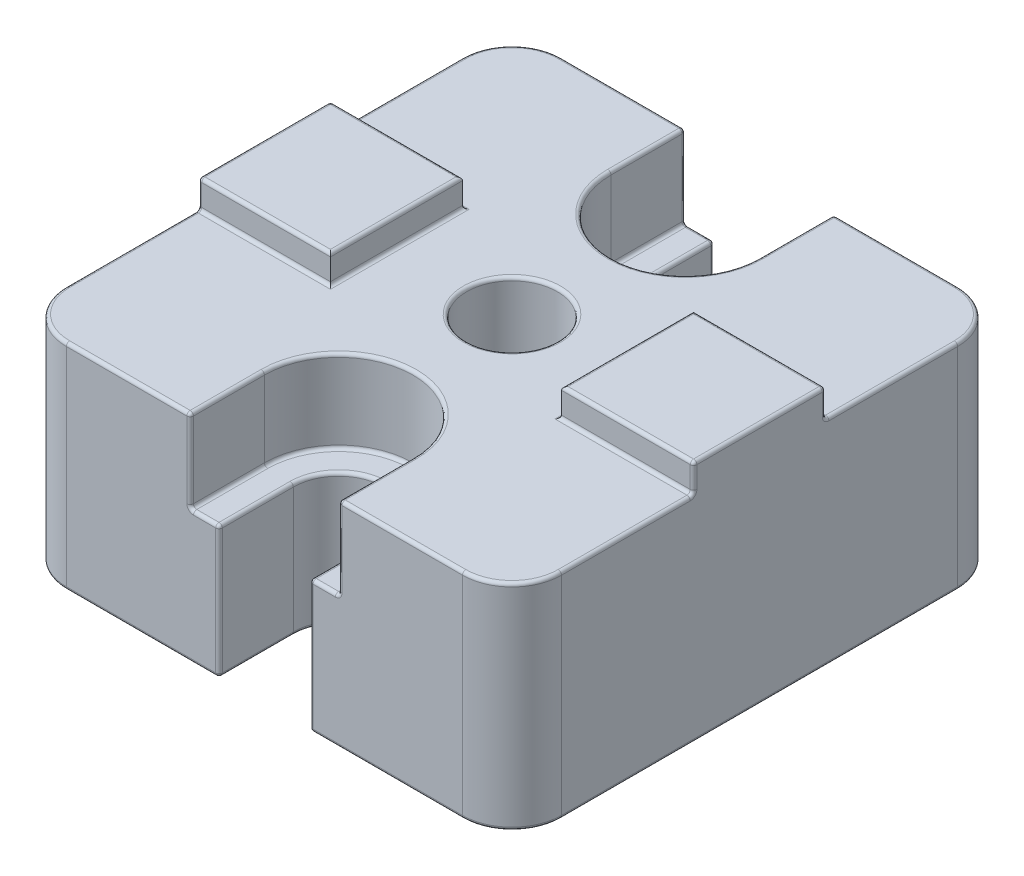
from build123d import *

# Parameters (mm, degrees)
BOSS_EXTRUDE1_DEPTH = 13
BOSS_EXTRUDE2_DEPTH = 1.7
CUT_EXTRUDE1_DEPTH  = 5
SKETCH4_R           = 2.75
CUT_EXTRUDE2_DEPTH  = 35
SKETCH5_R           = 4.6
CUT_EXTRUDE3_DEPTH  = 6
FILLET1_R           = 0.2


with BuildPart() as part:
    # Sketch1 → Boss-Extrude1 (new body)
    with BuildSketch(Plane(origin=(0, 0, 0), x_dir=(1, 0, 0), z_dir=(0, 1, 0))):
        with BuildLine():
            Line((2.75, -10.5), (2.75, -14.8))
            ThreePointArc((2.75, -14.8), (2.808578644, -14.941421356), (2.95, -15))
            Line((2.95, -15), (12, -15))
            ThreePointArc((12, -15), (14.121320344, -14.121320344), (15, -12))
            Line((15, -12), (15, 12))
            ThreePointArc((15, 12), (14.121320344, 14.121320344), (12, 15))
            Line((12, 15), (2.95, 15))
            ThreePointArc((2.95, 15), (2.808578644, 14.941421356), (2.75, 14.8))
            Line((2.75, 14.8), (2.75, 10.5))
            ThreePointArc((2.75, 10.5), (0, 7.75), (-2.75, 10.5))
            Line((-2.75, 10.5), (-2.75, 14.8))
            ThreePointArc((-2.75, 14.8), (-2.808578644, 14.941421356), (-2.95, 15))
            Line((-2.95, 15), (-12, 15))
            ThreePointArc((-12, 15), (-14.121320344, 14.121320344), (-15, 12))
            Line((-15, 12), (-15, -12))
            ThreePointArc((-15, -12), (-14.121320344, -14.121320344), (-12, -15))
            Line((-12, -15), (-2.95, -15))
            ThreePointArc((-2.95, -15), (-2.808578644, -14.941421356), (-2.75, -14.8))
            Line((-2.75, -14.8), (-2.75, -10.5))
            ThreePointArc((-2.75, -10.5), (0, -7.75), (2.75, -10.5))
        make_face()
    extrude(amount=BOSS_EXTRUDE1_DEPTH)

    # Sketch2 → Boss-Extrude2 (add)
    with BuildSketch(Plane(origin=(0, 13, 0), x_dir=(1, 0, 0), z_dir=(0, 1, 0))):
        Polygon((7.2, 4), (14.8, 4), (15, 4), (15, -3.8), (15, -4), (7, -4), (7, -3.8), (7, 4), align=None)
    boss_extrude2 = extrude(amount=BOSS_EXTRUDE2_DEPTH)

    # Mirror1: Boss-Extrude2 across plane
    add(boss_extrude2.mirror(Plane(origin=(0, 0, 0), x_dir=(0, 0, 1), z_dir=(1, 0, 0))))

    # Sketch3 → Cut-Extrude1 (cut)
    with BuildSketch(Plane(origin=(0, 13, 0), x_dir=(1, 0, 0), z_dir=(0, 1, 0))):
        with BuildLine():
            Line((4.5, 14.8), (4.5, 10.5))
            ThreePointArc((4.5, 10.5), (0, 6), (-4.5, 10.5))
            Line((-4.5, 10.5), (-4.5, 14.8))
            Line((-4.5, 14.8), (-4.5, 15))
            Line((-4.5, 15), (4.5, 15))
            Line((4.5, 15), (4.5, 14.8))
        make_face()
    cut_extrude1 = extrude(amount=-CUT_EXTRUDE1_DEPTH, mode=Mode.SUBTRACT)

    # Mirror2: Cut-Extrude1 across plane
    add(cut_extrude1.mirror(Plane.XY), mode=Mode.SUBTRACT)

    # Sketch4 → Cut-Extrude2 (cut)
    with BuildSketch(Plane(origin=(0, 13, 0), x_dir=(1, 0, 0), z_dir=(0, 1, 0))):
        with Locations(Location((0, 0, 0), (0, 0, 270))):
            Circle(SKETCH4_R)
    extrude(amount=-CUT_EXTRUDE2_DEPTH, mode=Mode.SUBTRACT)

    # Sketch5 → Cut-Extrude3 (cut)
    with BuildSketch(Plane.XZ):
        with Locations(Location((0, 0, 0), (0, 0, 270))):
            Circle(SKETCH5_R)
    extrude(amount=-CUT_EXTRUDE3_DEPTH, mode=Mode.SUBTRACT)

    # Fillet1
    fillet1_edges = [part.edges().sort_by_distance(p)[0] for p in [
        (0, 8, -7.75),
        (-4.5, 13, -12.75),
        (0, 13, -6),
        (4.5, 13, -12.75),
        (-3.725, 8, -15),
        (-4.5, 10.5, -15),
        (4.5, 8, -12.75),
        (4.5, 10.5, -15),
        (0, 8, -6),
        (-4.5, 8, -12.75),
        (3.725, 8, -15),
        (2.808578644, 8, -14.941421356),
        (2.75, 8, -12.65),
        (-2.75, 8, -12.65),
        (-2.808578644, 8, -14.941421356),
        (8.25, 13, 15),
        (-14.121320344, 13, 14.121320344),
        (-3.725, 8, 15),
        (-4.5, 8, 12.75),
        (0, 8, 6),
        (4.5, 8, 12.75),
        (3.725, 8, 15),
        (0, 8, 7.75),
        (4.5, 10.5, 15),
        (-4.5, 13, 12.75),
        (-4.5, 10.5, 15),
        (0, 13, 6),
        (4.5, 13, 12.75),
        (-2.808578644, 8, 14.941421356),
        (-2.75, 8, 12.65),
        (2.75, 8, 12.65),
        (2.808578644, 8, 14.941421356),
        (0, 13, -2.75),
        (-8.25, 13, 15),
        (-7.475, 0, -15),
        (-2.808578644, 0, -14.941421356),
        (-2.75, 0, -12.65),
        (0, 0, -7.75),
        (2.75, 0, -12.65),
        (2.808578644, 0, -14.941421356),
        (7.475, 0, -15),
        (14.121320344, 0, -14.121320344),
        (15, 0, 0),
        (14.121320344, 0, 14.121320344),
        (7.475, 0, 15),
        (2.808578644, 0, 14.941421356),
        (2.75, 0, 12.65),
        (0, 0, 7.75),
        (-2.75, 0, 12.65),
        (-2.808578644, 0, 14.941421356),
        (-7.475, 0, 15),
        (-14.121320344, 0, 14.121320344),
        (-15, 0, 0),
        (-14.121320344, 0, -14.121320344),
        (14.121320344, 13, 14.121320344),
        (15, 13, 8),
        (-14.121320344, 13, -14.121320344),
        (14.121320344, 13, -14.121320344),
        (8.25, 13, -15),
        (15, 13, -8),
        (7, 13, 0),
        (11, 13, 4),
        (15, 13.85, 4),
        (11, 13, -4),
        (15, 13.85, -4),
        (11, 14.7, -4),
        (7, 14.7, 0),
        (11, 14.7, 4),
        (15, 14.7, 0),
        (-15, 13, 8),
        (-11, 14.7, -4),
        (-15, 14.7, 0),
        (-15, 13.85, -4),
        (-11, 14.7, 4),
        (-15, 13.85, 4),
        (-7, 14.7, 0),
        (-11, 13, -4),
        (-7, 13, 0),
        (-11, 13, 4),
        (-15, 13, -8),
        (-8.25, 13, -15),
    ]]
    fillet(fillet1_edges, radius=FILLET1_R)


solid = part.part
